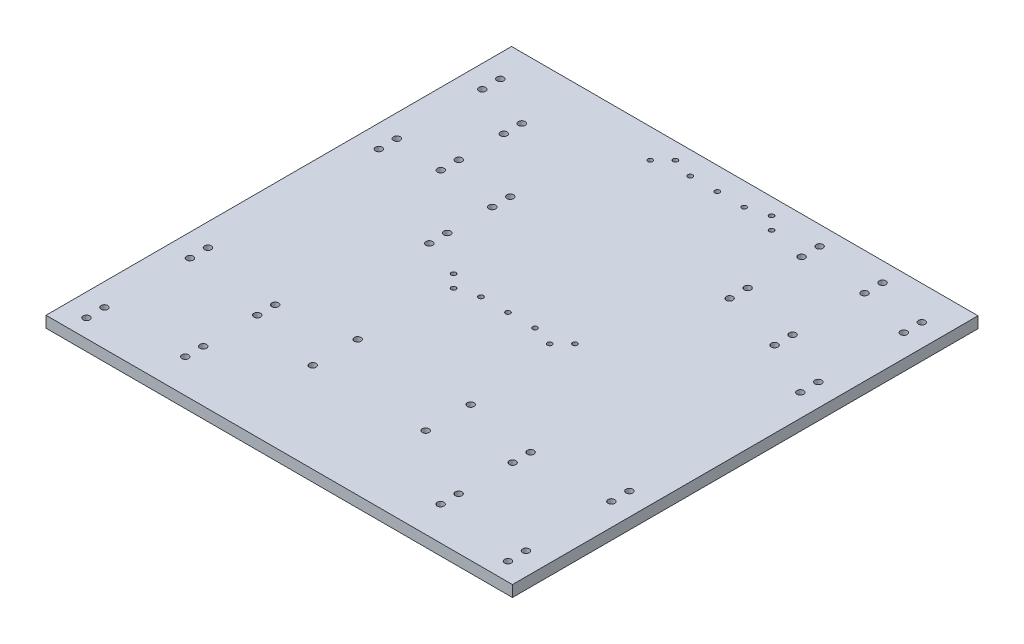
from build123d import *

# Parameters (mm, degrees)
SKETCH1_W                 = 263.40054
SKETCH1_H                 = 254
BOSS_EXTRUDE1_DEPTH       = 6.35
F_6_CLEARANCE_HOLE1_D     = 3.7973
F_6_CLEARANCE_HOLE2_D     = 3.7973
F_6_CLEARANCE_HOLE3_D     = 3.7973
F_6_CLEARANCE_HOLE4_D     = 3.7973
MIRROR2_COPY_1_D          = 3.7973
F_6_CLEARANCE_HOLE5_D     = 3.7973
F_6_CLEARANCE_HOLE6_D     = 3.7973
TAP_DRILL_FOR_6_32_TAP1_D = 2.7051
TAP_DRILL_FOR_6_32_TAP2_D = 2.7051
TAP_DRILL_FOR_6_32_TAP3_D = 2.7051
F_6_CLEARANCE_HOLE7_D     = 3.7973
SKETCH23_W                = 263.40054
SKETCH23_H                = 8.89
BOSS_EXTRUDE2_DEPTH       = 6.35
SKETCH24_R                = 1.35255
CUT_EXTRUDE1_DEPTH        = 190.344595165


with BuildPart() as part:
    # Sketch1 → Boss-Extrude1 (new body)
    with BuildSketch(Plane(origin=(0, 0, 0), x_dir=(1, 0, 0), z_dir=(0, 1, 0))):
        Rectangle(SKETCH1_W, SKETCH1_H)
    extrude(amount=BOSS_EXTRUDE1_DEPTH)

    # #6 Clearance Hole1 (through all)
    with Locations(Plane(origin=(0, 6.35, 0), x_dir=(1, 0, 0), z_dir=(0, 1, 0))):
        with Locations((119.00027, 116.84), (119.00027, 106.68), (119.00027, 58.42), (119.00027, 48.26)):
            f_6_clearance_hole1 = Hole(F_6_CLEARANCE_HOLE1_D / 2)

    # Mirror1: #6 Clearance Hole1 across plane
    add(f_6_clearance_hole1.mirror(Plane(origin=(0, 0, 0), x_dir=(1, 0, 0), z_dir=(0, 0, -1))), mode=Mode.SUBTRACT)

    # #6 Clearance Hole2 (through all)
    with Locations(Plane(origin=(0, 6.35, 0), x_dir=(1, 0, 0), z_dir=(0, 1, 0))):
        with Locations((88.61933, 125.06198), (88.61933, 114.90198), (88.61933, 74.26198), (88.61933, 64.10198)):
            Hole(F_6_CLEARANCE_HOLE2_D / 2)

    # #6 Clearance Hole3 (through all)
    with Locations(Plane(origin=(0, 6.35, 0), x_dir=(1, 0, 0), z_dir=(0, 1, 0))):
        with Locations((53.05933, 125.06198), (53.05933, 114.90198), (53.05933, 84.42198), (53.05933, 74.26198)):
            Hole(F_6_CLEARANCE_HOLE3_D / 2)

    # #6 Clearance Hole4 (through all)
    with Locations(Plane(origin=(0, 6.35, 0), x_dir=(1, 0, 0), z_dir=(0, 1, 0))):
        with Locations((72.11187, -57.17032), (72.11187, -67.33032), (72.11187, -97.81032), (72.11187, -107.97032)):
            f_6_clearance_hole4 = Hole(F_6_CLEARANCE_HOLE4_D / 2)

    # Mirror2: #6 Clearance Hole1, #6 Clearance Hole4 across plane
    add(f_6_clearance_hole1.mirror(Plane.ZY), mode=Mode.SUBTRACT)
    add(f_6_clearance_hole4.mirror(Plane.ZY), mode=Mode.SUBTRACT)

    # Mirror2 copy 1 (through all)
    with Locations(Plane(origin=(0, 6.35, 0), x_dir=(-1, 0, 0), z_dir=(0, 1, 0))):
        with Locations((119.00027, 116.84), (119.00027, 106.68), (119.00027, 58.42), (119.00027, 48.26)):
            Hole(MIRROR2_COPY_1_D / 2)

    # #6 Clearance Hole5 (through all)
    with Locations(Plane(origin=(0, 6.35, 0), x_dir=(1, 0, 0), z_dir=(0, 1, 0))):
        with Locations((-91.16187, 101.12248), (-91.16187, 90.96248), (-91.16187, 65.56248), (-91.16187, 55.40248)):
            Hole(F_6_CLEARANCE_HOLE5_D / 2)

    # #6 Clearance Hole6 (through all)
    with Locations(Plane(origin=(0, 6.35, 0), x_dir=(1, 0, 0), z_dir=(0, 1, 0))):
        with Locations((-58.61685, 62.06998), (-58.61685, 51.90998), (-58.61685, 26.50998), (-58.61685, 16.34998)):
            Hole(F_6_CLEARANCE_HOLE6_D / 2)

    # Tap Drill for #6-32 Tap1 (through all)
    with Locations(Plane(origin=(0, 6.35, 0), x_dir=(1, 0, 0), z_dir=(0, 1, 0))):
        with Locations((-36.91763, 8.35914), (-29.80563, 1.24714)):
            Hole(TAP_DRILL_FOR_6_32_TAP1_D / 2)

    # Tap Drill for #6-32 Tap2 (through all)
    with Locations(Plane(origin=(0, 6.35, 0), x_dir=(1, 0, 0), z_dir=(0, 1, 0))):
        with Locations((-29.80563, 126.51232), (-36.91763, 119.40032)):
            Hole(TAP_DRILL_FOR_6_32_TAP2_D / 2)

    # Tap Drill for #6-32 Tap3 (through all)
    with Locations(Plane(origin=(0, 6.35, 0), x_dir=(1, 0, 0), z_dir=(0, 1, 0))):
        with Locations((-17.89049, 4.80314), (-2.65049, 4.80314), (12.58951, 4.80314), (-17.890285947, 122.95632), (-2.65049, 123.035183862), (12.589305947, 122.95632), (24.50465, 126.51232), (31.61665, 119.40032), (24.50465, 1.24714), (31.61665, 8.35914)):
            Hole(TAP_DRILL_FOR_6_32_TAP3_D / 2)

    # #6 Clearance Hole7 (through all)
    with Locations(Plane(origin=(0, 6.35, 0), x_dir=(1, 0, 0), z_dir=(0, 1, 0))):
        with Locations((-31.92145, -50.8), (-31.92145, -76.2), (31.92145, -76.2), (31.92145, -50.8)):
            Hole(F_6_CLEARANCE_HOLE7_D / 2)

    # Sketch23 → Boss-Extrude2 (add)
    with BuildSketch(Plane(origin=(0, 6.35, 0), x_dir=(1, 0, 0), z_dir=(0, 1, 0))):
        with Locations((0, 131.445)):
            Rectangle(SKETCH23_W, SKETCH23_H)
    extrude(amount=-BOSS_EXTRUDE2_DEPTH)

    # Sketch24 → Cut-Extrude1 (cut, through all)
    with BuildSketch(Plane(origin=(0, 6.35, 0), x_dir=(1, 0, 0), z_dir=(0, 1, 0))):
        with Locations(Location((-29.80563, 126.51232, 0), (0, 0, 270))):
            Circle(SKETCH24_R)
        with Locations(Location((24.50465, 126.51232, 0), (0, 0, 270))):
            Circle(SKETCH24_R)
    extrude(amount=-CUT_EXTRUDE1_DEPTH, mode=Mode.SUBTRACT)


solid = part.part
